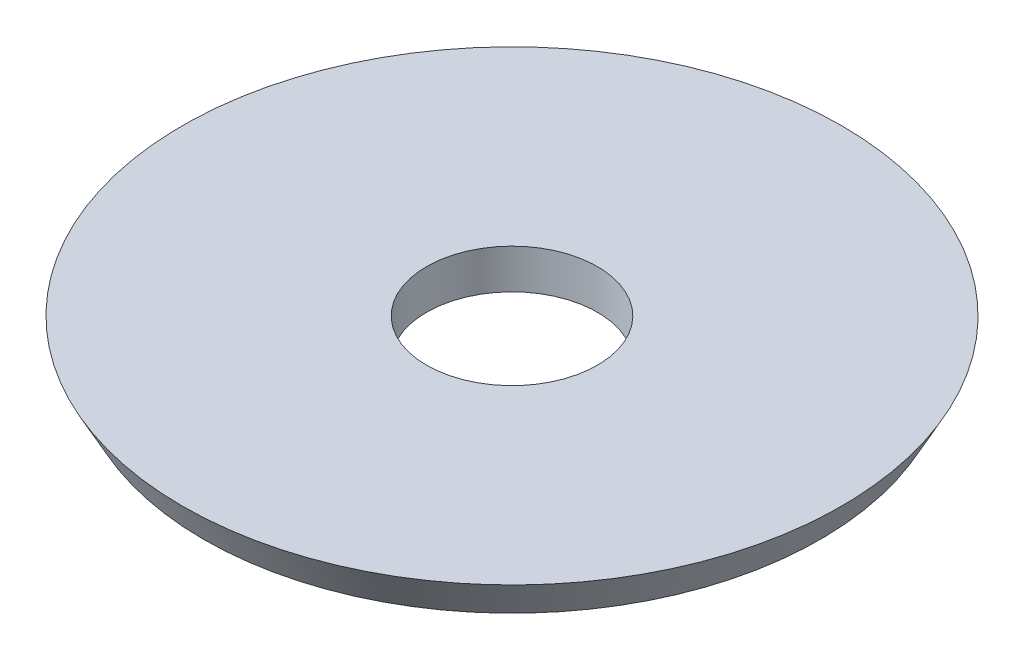
from build123d import *

# Parameters (mm, degrees)
SKETCH1_R          = 10.82
SKETCH2_R          = 11.57
SKETCH9_R          = 3
CUT_EXTRUDE1_DEPTH = 3


with BuildPart() as part:
    # Sketch1 → Loft2 section 0
    with BuildSketch(Plane(origin=(0, 0, 0), x_dir=(1, 0, 0), z_dir=(0, 1, 0))):
        Circle(SKETCH1_R)
    # Sketch2 → Loft2 section 1
    with BuildSketch(Plane(origin=(0, 1.39, 0), x_dir=(1, 0, 0), z_dir=(0, 1, 0))):
        Circle(SKETCH2_R)
    loft()

    # Sketch9 → Cut-Extrude1 (cut)
    with BuildSketch(Plane(origin=(0, 1.39, 0), x_dir=(1, 0, 0), z_dir=(0, 1, 0))):
        with Locations(Location((0, 0, 0), (0, 0, 270))):
            Circle(SKETCH9_R)
    extrude(amount=-CUT_EXTRUDE1_DEPTH, mode=Mode.SUBTRACT)


solid = part.part
